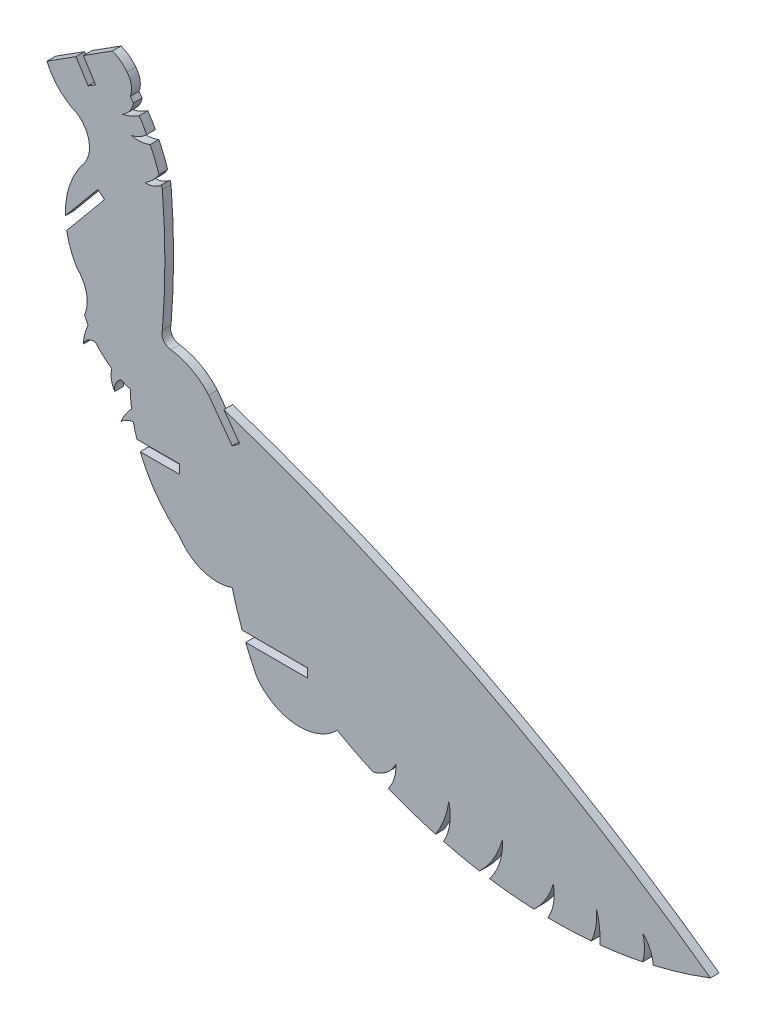
from build123d import *

# Parameters (mm, degrees)
BOSS_EXTRUDE1_DEPTH = 1.524


with BuildPart() as part:
    # Sketch1 → Boss-Extrude1 (new body)
    with BuildSketch(Plane.XY):
        with BuildLine():
            Line((56.264141338, 126.956858816), (51.174858052, 123.732229714))
            Line((51.174858052, 123.732229714), (53.307781304, 120.365935384))
            Line((53.307781304, 120.365935384), (52.020439004, 119.550260325))
            Line((52.020439004, 119.550260325), (49.887515751, 122.916554654))
            Line((49.887515751, 122.916554654), (44.798232465, 119.691925553))
            ThreePointArc((44.798232465, 119.691925553), (46.919348528, 116.541161993), (50.056966547, 114.400648613))
            ThreePointArc((50.056966547, 114.400648613), (52.160922541, 111.249416579), (51.38551555, 107.540557165))
            ThreePointArc((51.38551555, 107.540557165), (48.819467631, 103.01456573), (48.033803289, 97.871421561))
            Line((48.033803289, 97.871421561), (53.714736294, 104.703768794))
            Line((53.714736294, 104.703768794), (54.886575206, 103.729412819))
            Line((54.886575206, 103.729412819), (48.256070281, 95.755033975))
            ThreePointArc((48.256070281, 95.755033975), (48.940021774, 93.270180673), (50.056966547, 90.947527029))
            ThreePointArc((50.056966547, 90.947527029), (51.738858239, 87.952338233), (51.38551555, 84.535458878))
            ThreePointArc((51.38551555, 84.535458878), (51.676023362, 83.881512061), (52.003112941, 83.245073819))
            ThreePointArc((52.003112941, 83.245073819), (51.432071992, 81.656527536), (51.174858052, 79.988172643))
            ThreePointArc((51.174858052, 79.988172643), (52.003112941, 81.035329758), (53.307781304, 81.318851624))
            ThreePointArc((53.307781304, 81.318851624), (54.639987623, 79.928222594), (56.168191464, 78.75637969))
            ThreePointArc((56.168191464, 78.75637969), (56.082073865, 77.101010294), (56.669286419, 75.550898847))
            ThreePointArc((56.669286419, 75.550898847), (56.856082806, 76.879297739), (57.74991105, 77.879601482))
            ThreePointArc((57.74991105, 77.879601482), (58.566064016, 77.535130701), (59.404362787, 77.2487377))
            ThreePointArc((59.404362787, 77.2487377), (59.468887944, 75.800864539), (59.621212135, 74.359581247))
            ThreePointArc((59.621212135, 74.359581247), (58.548532564, 73.021617268), (57.74991105, 71.50405582))
            ThreePointArc((57.74991105, 71.50405582), (58.750795137, 72.225661043), (59.934465672, 72.574096285))
            ThreePointArc((59.934465672, 72.574096285), (60.218266334, 71.399198054), (60.56120896, 70.240181651))
            Line((60.56120896, 70.240181651), (68.053425724, 70.240181651))
            Line((68.053425724, 70.240181651), (68.053425724, 68.651586531))
            Line((68.053425724, 68.651586531), (61.138299457, 68.651586531))
            ThreePointArc((61.138299457, 68.651586531), (64.007218606, 63.496556651), (68.053425724, 59.203161944))
            ThreePointArc((68.053425724, 59.203161944), (72.105402023, 56.054971734), (77.236381434, 56.106583856))
            ThreePointArc((77.236381434, 56.106583856), (78.044746131, 53.287579438), (78.998529881, 50.51439788))
            Line((78.998529881, 50.51439788), (90.459222019, 50.51439788))
            Line((90.459222019, 50.51439788), (90.459222019, 48.97144986))
            Line((90.459222019, 48.97144986), (79.600424402, 48.97144986))
            ThreePointArc((79.600424402, 48.97144986), (80.560218525, 46.751381797), (81.614302179, 44.574499941))
            ThreePointArc((81.614302179, 44.574499941), (88.40638605, 40.908931841), (95.623925921, 43.643143066))
            ThreePointArc((95.623925921, 43.643143066), (98.719457239, 41.9837065), (101.887587861, 40.467463703))
            ThreePointArc((101.887587861, 40.467463703), (104.250570747, 41.59409239), (105.879794993, 43.643143066))
            ThreePointArc((105.879794993, 43.643143066), (105.615285106, 41.362757758), (104.568635279, 39.319562522))
            ThreePointArc((104.568635279, 39.319562522), (108.662838982, 37.791938771), (112.83726515, 36.499536179))
            ThreePointArc((112.83726515, 36.499536179), (114.338838664, 39.431267188), (115.158578251, 42.621533122))
            ThreePointArc((115.158578251, 42.621533122), (115.32642817, 39.283498881), (114.23888805, 36.123134554))
            ThreePointArc((114.23888805, 36.123134554), (117.382688145, 35.380759015), (120.554912672, 34.771175532))
            ThreePointArc((120.554912672, 34.771175532), (123.021749605, 37.9129634), (124.572686361, 41.59409239))
            ThreePointArc((124.572686361, 41.59409239), (124.074787113, 37.838934231), (122.294984417, 34.495071372))
            ThreePointArc((122.294984417, 34.495071372), (126.165693737, 34.02629014), (130.055199537, 33.754460929))
            ThreePointArc((130.055199537, 33.754460929), (132.134455488, 36.288278623), (133.465692892, 39.283498881))
            ThreePointArc((133.465692892, 39.283498881), (133.502994203, 36.396459224), (132.511774167, 33.684656833))
            ThreePointArc((132.511774167, 33.684656833), (136.324034113, 33.731918308), (140.129256944, 33.968220541))
            ThreePointArc((140.129256944, 33.968220541), (140.922011669, 36.642526439), (140.979432276, 39.431267188))
            ThreePointArc((140.979432276, 39.431267188), (141.543710337, 36.799823517), (141.584568778, 34.108869018))
            ThreePointArc((141.584568778, 34.108869018), (145.358502787, 34.60468639), (149.103252173, 35.286789609))
            ThreePointArc((149.103252173, 35.286789609), (149.41526381, 37.485880685), (149.103252173, 39.68497176))
            ThreePointArc((149.103252173, 39.68497176), (150.389458807, 37.857811323), (150.933061601, 35.690476839))
            ThreePointArc((150.933061601, 35.690476839), (155.995803512, 37.056053135), (160.953619193, 38.763746888))
            ThreePointArc((160.953619193, 38.763746888), (120.045431958, 63.84340718), (75.776786754, 82.357083072))
            Line((75.776786754, 82.357083072), (78.55577188, 78.549383563))
            Line((78.55577188, 78.549383563), (77.236381434, 77.586448747))
            Line((77.236381434, 77.586448747), (73.124487989, 83.220467621))
            ThreePointArc((73.124487989, 83.220467621), (70.129640963, 85.609264926), (66.488706533, 86.800507029))
            ThreePointArc((66.488706533, 86.800507029), (65.201078968, 87.547474126), (65.008773799, 89.023605324))
            ThreePointArc((65.008773799, 89.023605324), (65.45394794, 99.671148502), (65.008773799, 110.31869168))
            ThreePointArc((65.008773799, 110.31869168), (64.928240982, 110.624021202), (64.844587925, 110.928510639))
            ThreePointArc((64.844587925, 110.928510639), (63.504830628, 110.096374776), (61.945041493, 109.863013337))
            ThreePointArc((61.945041493, 109.863013337), (63.331098083, 110.928510639), (64.429350166, 112.288760519))
            ThreePointArc((64.429350166, 112.288760519), (63.72134744, 114.213049759), (62.887114334, 116.086071934))
            ThreePointArc((62.887114334, 116.086071934), (61.244379947, 115.688493307), (59.559011987, 115.815693414))
            ThreePointArc((59.559011987, 115.815693414), (61.021114976, 116.355052106), (62.272659221, 117.283647794))
            ThreePointArc((62.272659221, 117.283647794), (61.637025251, 118.402299275), (60.955310984, 119.493480899))
            ThreePointArc((60.955310984, 119.493480899), (59.559011987, 118.734336878), (58.039485129, 118.268516457))
            ThreePointArc((58.039485129, 118.268516457), (59.291178035, 119.385811258), (59.960570457, 120.924315918))
            ThreePointArc((59.960570457, 120.924315918), (59.685184939, 121.291735218), (59.404362787, 121.655016161))
            ThreePointArc((59.404362787, 121.655016161), (59.583464699, 123.412306739), (58.847642556, 125.018144041))
            ThreePointArc((58.847642556, 125.018144041), (57.697156367, 126.175748202), (56.264141338, 126.956858816))
        make_face()
    extrude(amount=BOSS_EXTRUDE1_DEPTH)


solid = part.part
